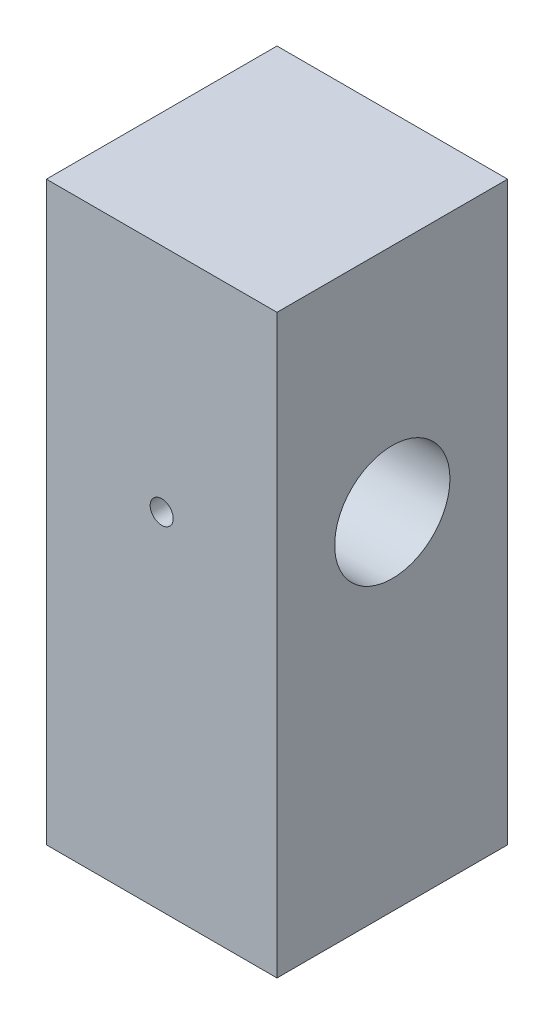
from build123d import *

# Parameters (mm, degrees)
SKETCH1_W           = 50
SKETCH1_H           = 20
SKETCH1_R           = 5
BOSS_EXTRUDE3_DEPTH = 20
SKETCH2_R           = 1
CUT_EXTRUDE1_DEPTH  = 38.749172176


with BuildPart() as part:
    # Sketch1 → Boss-Extrude3 (new body)
    with BuildSketch(Plane.YZ):
        Rectangle(SKETCH1_W, SKETCH1_H)
        with Locations(Location((5, 0, 0), (0, 0, 270))):
            Circle(SKETCH1_R, mode=Mode.SUBTRACT)
    extrude(amount=BOSS_EXTRUDE3_DEPTH)

    # Sketch2 → Cut-Extrude1 (cut, through all)
    with BuildSketch(Plane(origin=(0, 0, -10), x_dir=(1, 0, 0), z_dir=(0, 0, -1))):
        with Locations(Location((10, -5, 0), (0, 0, 270))):
            Circle(SKETCH2_R)
    extrude(amount=-CUT_EXTRUDE1_DEPTH, mode=Mode.SUBTRACT)


solid = part.part
